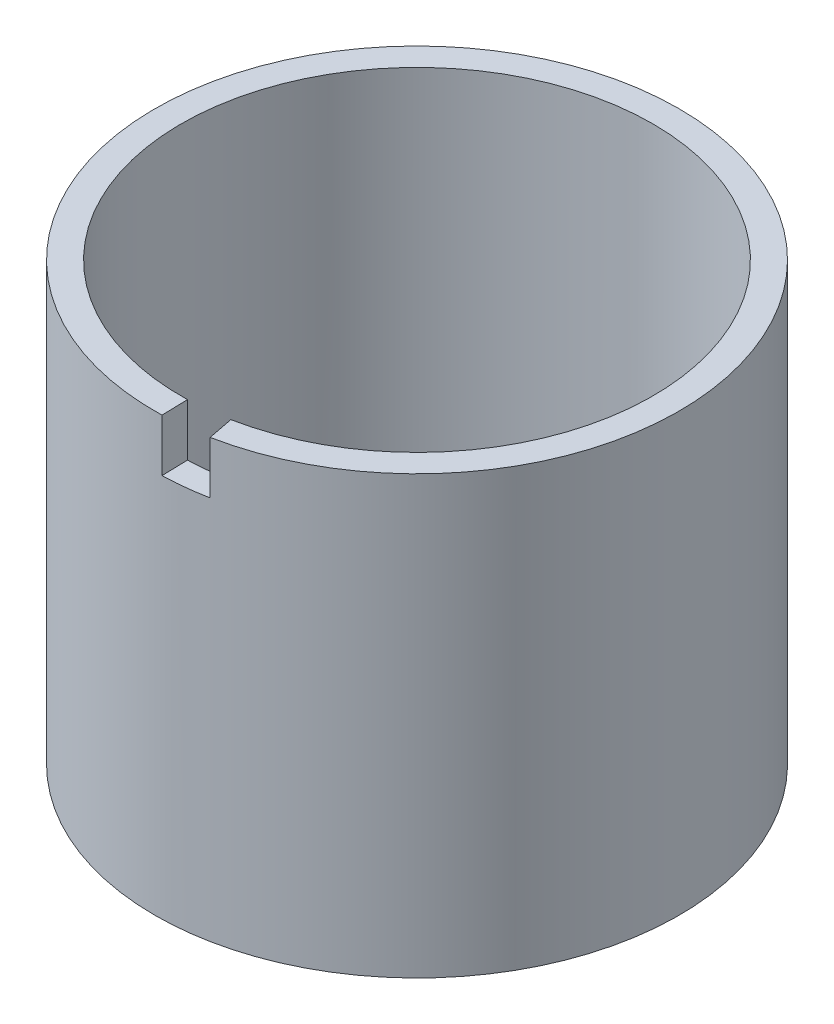
from build123d import *

# Parameters (mm, degrees)
SKETCH1_R           = 15
BOSS_EXTRUDE1_DEPTH = 25
SHELL2_T            = -1.5
CUT_EXTRUDE1_START  = -3
CUT_EXTRUDE1_DEPTH  = 3


with BuildPart() as part:
    # Sketch1 → Boss-Extrude1 (new body)
    with BuildSketch(Plane(origin=(0, 0, 0), x_dir=(1, 0, 0), z_dir=(0, 1, 0))):
        with Locations(Location((0, 0, 0), (0, 0, 270))):
            Circle(SKETCH1_R)
    extrude(amount=BOSS_EXTRUDE1_DEPTH)

    # Shell2
    shell2_openings = [part.faces().sort_by_distance(p)[0] for p in [
        (0, 25, 0),
    ]]
    offset(amount=SHELL2_T, openings=shell2_openings, kind=Kind.INTERSECTION)

    # Sketch2 → Cut-Extrude1 (cut)
    with BuildSketch(Plane(origin=(0, 25, 0), x_dir=(1, 0, 0), z_dir=(0, 1, 0)).offset(CUT_EXTRUDE1_START)):
        with BuildLine():
            Line((0.356193266, -13.495300158), (0.395770296, -14.994777953))
            ThreePointArc((0.395770296, -14.994777953), (1.642962601, -14.909750967), (2.878743851, -14.721169581))
            Line((2.878743851, -14.721169581), (2.590869465, -13.249052623))
            ThreePointArc((2.590869465, -13.249052623), (1.478666341, -13.41877587), (0.356193266, -13.495300158))
        make_face()
    extrude(amount=CUT_EXTRUDE1_DEPTH, mode=Mode.SUBTRACT)


solid = part.part
